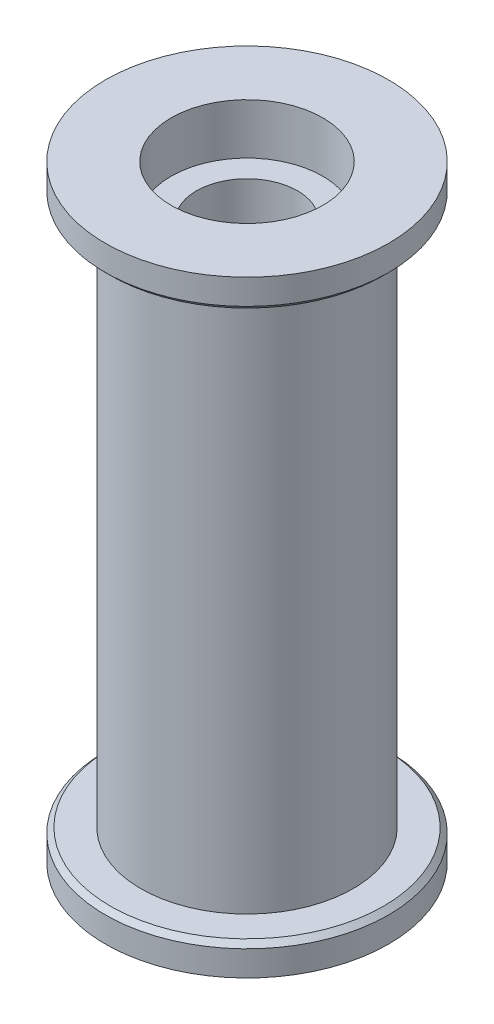
from build123d import *

# Parameters (mm, degrees)
CHAMFER_1_SIZE = 0.5


with BuildPart() as part:
    # 草图1 → 旋转1 (revolve)
    with BuildSketch(Plane.XY, mode=Mode.PRIVATE) as revolve_1_sk:
        Polygon((7.5, -55), (7.5, -60), (14, -60), (14, -57), (10.5, -57), (10.5, -3), (14, -3), (14, 0), (7.5, 0), (7.5, -5), (5, -5), (5, -55), align=None)
    revolve(revolve_1_sk.sketch.rotate(Axis((0, 0, 0), (0, -1, 0)), 180), axis=Axis((0, 0, 0), (0, -1, 0)))

    # 倒角1
    chamfer_1_edges = [part.edges().sort_by_distance(p)[0] for p in [
        (14, -3, 0),
        (14, -57, 0),
    ]]
    chamfer(chamfer_1_edges, length=CHAMFER_1_SIZE)


solid = part.part
